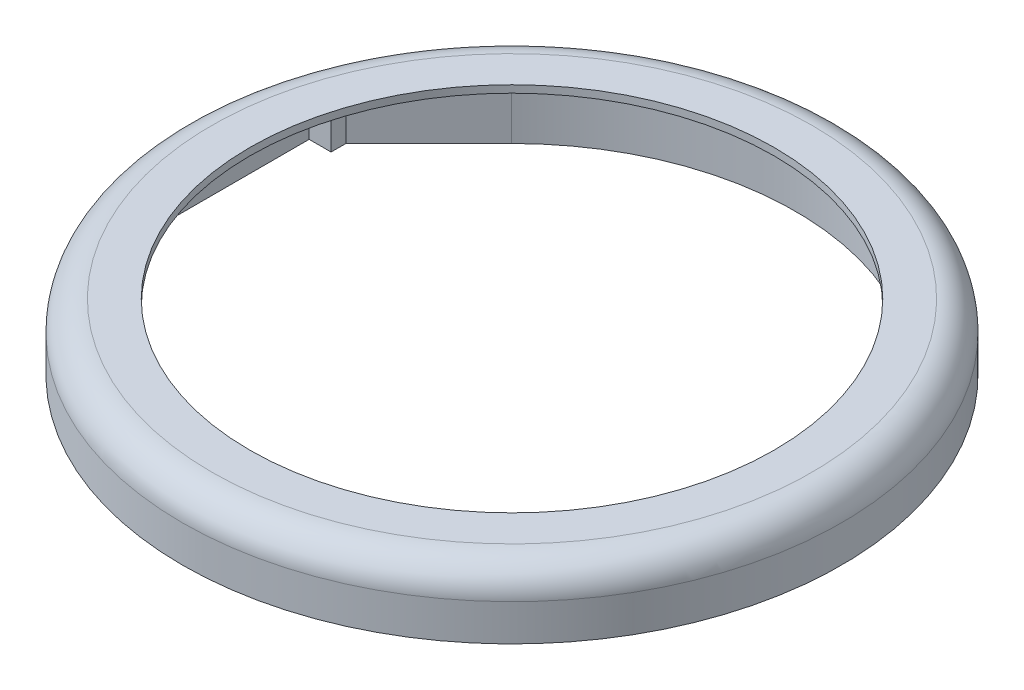
from build123d import *

# Parameters (mm, degrees)
SKETCH1_R           = 22.5
BOSS_EXTRUDE1_DEPTH = 4.5
SKETCH2_R           = 17.9
CUT_EXTRUDE1_DEPTH  = 33.136427928
CUT_EXTRUDE2_DEPTH  = 4
SKETCH4_W           = 1.5
SKETCH4_H           = 14
CUT_EXTRUDE3_DEPTH  = 3.2
FILLET2_R           = 2
SKETCH5_W           = 1.5
SKETCH5_H           = 5
CUT_EXTRUDE4_DEPTH  = 4
SKETCH6_R           = 1.5
CUT_EXTRUDE5_DEPTH  = 1.5
SKETCH7_R           = 1.5
CUT_EXTRUDE6_DEPTH  = 1.5
SKETCH8_R           = 1.5
CUT_EXTRUDE7_DEPTH  = 1.5


with BuildPart() as part:
    # Sketch1 → Boss-Extrude1 (new body)
    with BuildSketch(Plane(origin=(0, 0, 0), x_dir=(1, 0, 0), z_dir=(0, 1, 0))):
        with Locations(Location((0, 0, 0), (0, 0, 270))):
            Circle(SKETCH1_R)
    extrude(amount=BOSS_EXTRUDE1_DEPTH)

    # Sketch2 → Cut-Extrude1 (cut, through all)
    with BuildSketch(Plane(origin=(0, 4.5, 0), x_dir=(1, 0, 0), z_dir=(0, 1, 0))):
        with Locations(Location((0, 0, 0), (0, 0, 270))):
            Circle(SKETCH2_R)
    extrude(amount=-CUT_EXTRUDE1_DEPTH, mode=Mode.SUBTRACT)

    # Sketch3 → Cut-Extrude2 (cut)
    with BuildSketch(Plane.XZ):
        with BuildLine():
            Line((-13.700654905, -13.664353449), (-19.35, -8))
            Line((-19.35, -8), (-19.35, 8))
            Line((-19.35, 8), (-13.700654905, 13.664353449))
            ThreePointArc((-13.700654905, 13.664353449), (19.35, 0), (-13.700654905, -13.664353449))
        make_face()
    extrude(amount=-CUT_EXTRUDE2_DEPTH, mode=Mode.SUBTRACT)

    # Sketch4 → Cut-Extrude3 (cut)
    with BuildSketch(Plane.XZ):
        with Locations((-20.1, 0)):
            Rectangle(SKETCH4_W, SKETCH4_H)
    extrude(amount=-CUT_EXTRUDE3_DEPTH, mode=Mode.SUBTRACT)

    # Fillet2
    fillet2_edges = [part.edges().sort_by_distance(p)[0] for p in [
        (0, 4.5, -22.5),
    ]]
    fillet(fillet2_edges, radius=FILLET2_R)

    # Sketch5 → Cut-Extrude4 (cut)
    with BuildSketch(Plane.XZ):
        Polygon((-12.815063509, 17.196341101), (-12.065063509, 15.897302995), (-7.734936491, 18.397302995), (-8.484936491, 19.696341101), align=None)
        with Locations((20.55, 0)):
            Rectangle(SKETCH5_W, SKETCH5_H)
        Polygon((-12.815063509, -17.196341101), (-8.484936491, -19.696341101), (-7.734936491, -18.397302995), (-12.065063509, -15.897302995), align=None)
    extrude(amount=-CUT_EXTRUDE4_DEPTH, mode=Mode.SUBTRACT)

    # Sketch6 → Cut-Extrude5 (cut)
    with BuildSketch(Plane(origin=(-9.9, 0, 17.147302995), x_dir=(0.8660254037844397, 0, 0.4999999999999981), z_dir=(-0.4999999999999981, 0, 0.8660254037844397))):
        with Locations((2.5, 2.5)):
            Circle(SKETCH6_R)
        with Locations((-2.5, 2.5)):
            Circle(SKETCH6_R)
    extrude(amount=CUT_EXTRUDE5_DEPTH, mode=Mode.SUBTRACT)

    # Sketch7 → Cut-Extrude6 (cut)
    with BuildSketch(Plane(origin=(-9.9, 0, -17.147302995), x_dir=(-0.8660254037844364, 0, 0.500000000000004), z_dir=(-0.500000000000004, 0, -0.8660254037844365))):
        with Locations((-2.5, 2.5)):
            Circle(SKETCH7_R)
        with Locations((2.5, 2.5)):
            Circle(SKETCH7_R)
    extrude(amount=CUT_EXTRUDE6_DEPTH, mode=Mode.SUBTRACT)

    # Sketch8 → Cut-Extrude7 (cut)
    with BuildSketch(Plane(origin=(19.8, 0, 0), x_dir=(0, 0, -1), z_dir=(1, 0, 0))):
        with Locations((2.5, 2.5)):
            Circle(SKETCH8_R)
        with Locations((-2.5, 2.5)):
            Circle(SKETCH8_R)
    extrude(amount=CUT_EXTRUDE7_DEPTH, mode=Mode.SUBTRACT)


solid = part.part
